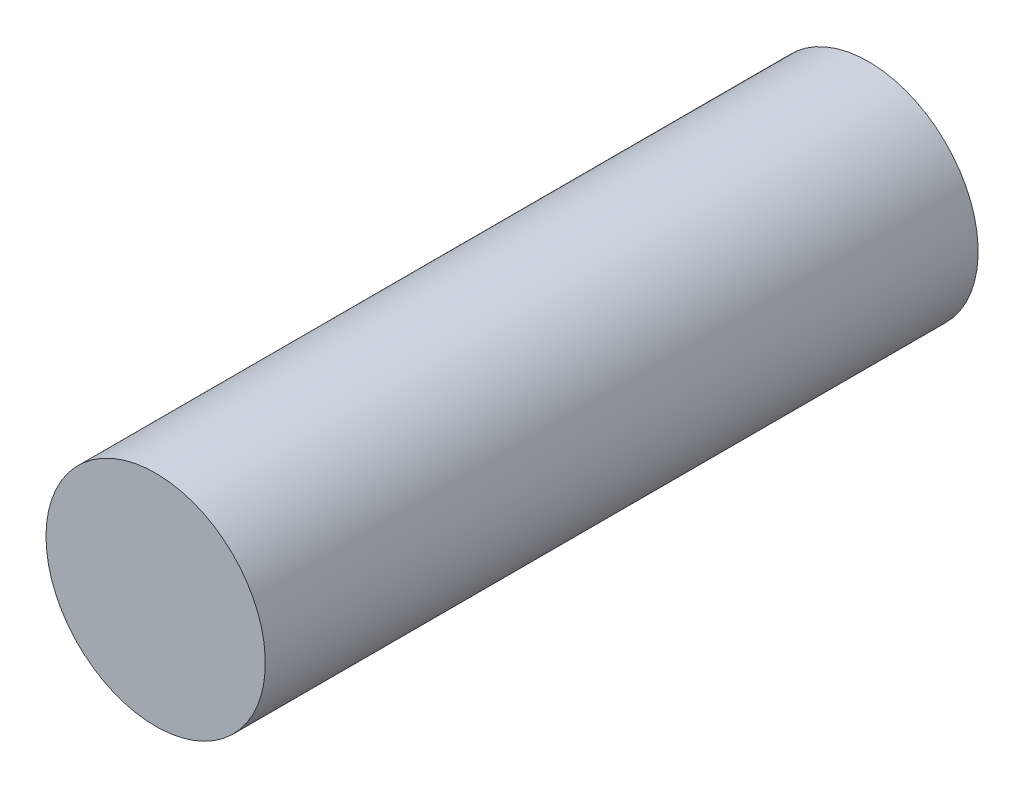
from build123d import *

# Parameters (mm, degrees)
SKETCH_1_R      = 4
EXTRUDE_1_DEPTH = 26


with BuildPart() as part:
    # 草图1 → 凸台-拉伸1 (new body)
    with BuildSketch(Plane.XY):
        with Locations(Location((0, 0, 0), (0, 0, 180))):
            Circle(SKETCH_1_R)
    extrude(amount=EXTRUDE_1_DEPTH)


solid = part.part
